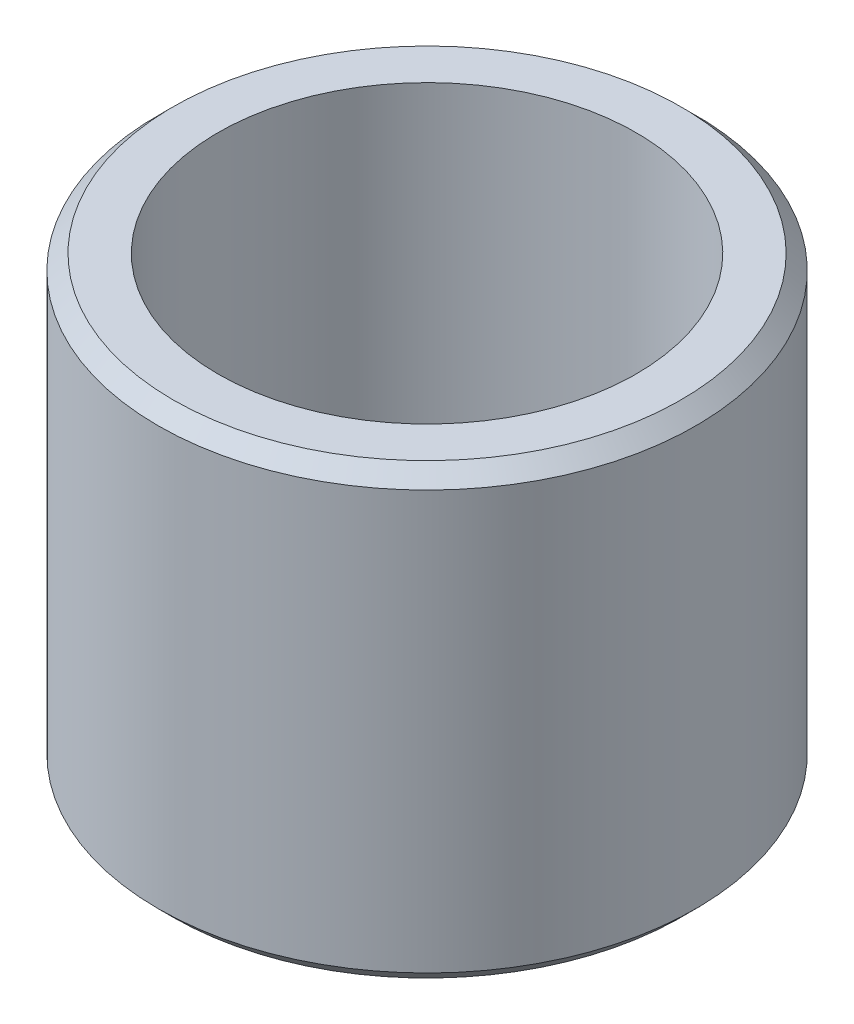
from build123d import *

# Parameters (mm, degrees)
SKETCH1_R           = 9
SKETCH1_R_2         = 7
BOSS_EXTRUDE1_DEPTH = 15
CHAMFER1_SIZE       = 0.5


with BuildPart() as part:
    # Sketch1 → Boss-Extrude1 (new body)
    with BuildSketch(Plane(origin=(0, 0, 0), x_dir=(1, 0, 0), z_dir=(0, 1, 0))):
        with Locations(Location((0, 0, 0), (0, 0, 270))):
            Circle(SKETCH1_R)
        with Locations(Location((0, 0, 0), (0, 0, 270))):
            Circle(SKETCH1_R_2, mode=Mode.SUBTRACT)
    extrude(amount=BOSS_EXTRUDE1_DEPTH)

    # Chamfer1
    chamfer1_edges = [part.edges().sort_by_distance(p)[0] for p in [
        (0, 0, -9),
        (0, 15, -9),
    ]]
    chamfer(chamfer1_edges, length=CHAMFER1_SIZE)


solid = part.part
